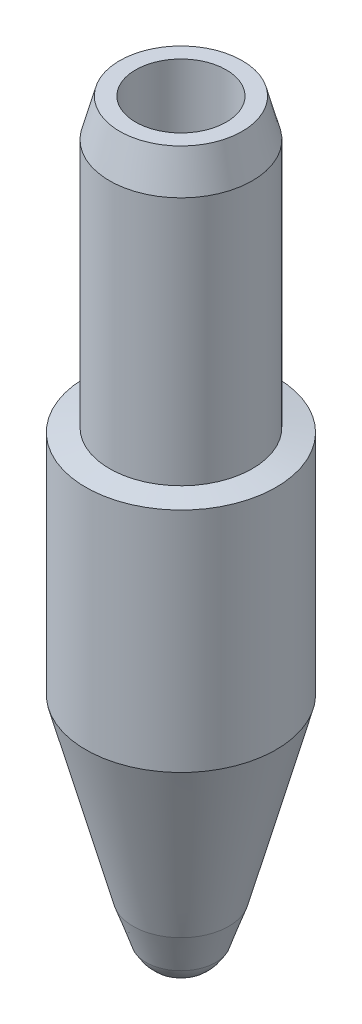
from build123d import *


with BuildPart() as part:
    # Esboço1 → Revolução1 (revolve)
    with BuildSketch(Plane.XY, mode=Mode.PRIVATE) as revolu_o1_sk:
        Polygon((0.633974596, 0.5), (1.26, 2.836358614), (1.26, 5.844457001), (0.945, 5.9), (0.945, 9.2), (0.811025404, 9.7), (0.6, 9.7), (0.6, 4.2), (0.45, 4.11339746), (0.45, 1.7), (0.150244133, 0), (0.462113614, 0), align=None)
    revolve(revolu_o1_sk.sketch.rotate(Axis((0, 0, 0), (0, 1, 0)), 90), axis=Axis((0, 0, 0), (0, 1, 0)))


with BuildPart() as body_2:
    # Esboço2 → Revolução2 (revolve)
    with BuildSketch(Plane.XY):
        with BuildLine():
            Line((0, 0.7), (0, -0.3))
            ThreePointArc((0, -0.3), (0.5, 0.2), (0, 0.7))
        make_face()
    revolve(axis=Axis((0, 0.7, 0), (0, -1, 0)))


solid = Compound([part.part, body_2.part])
